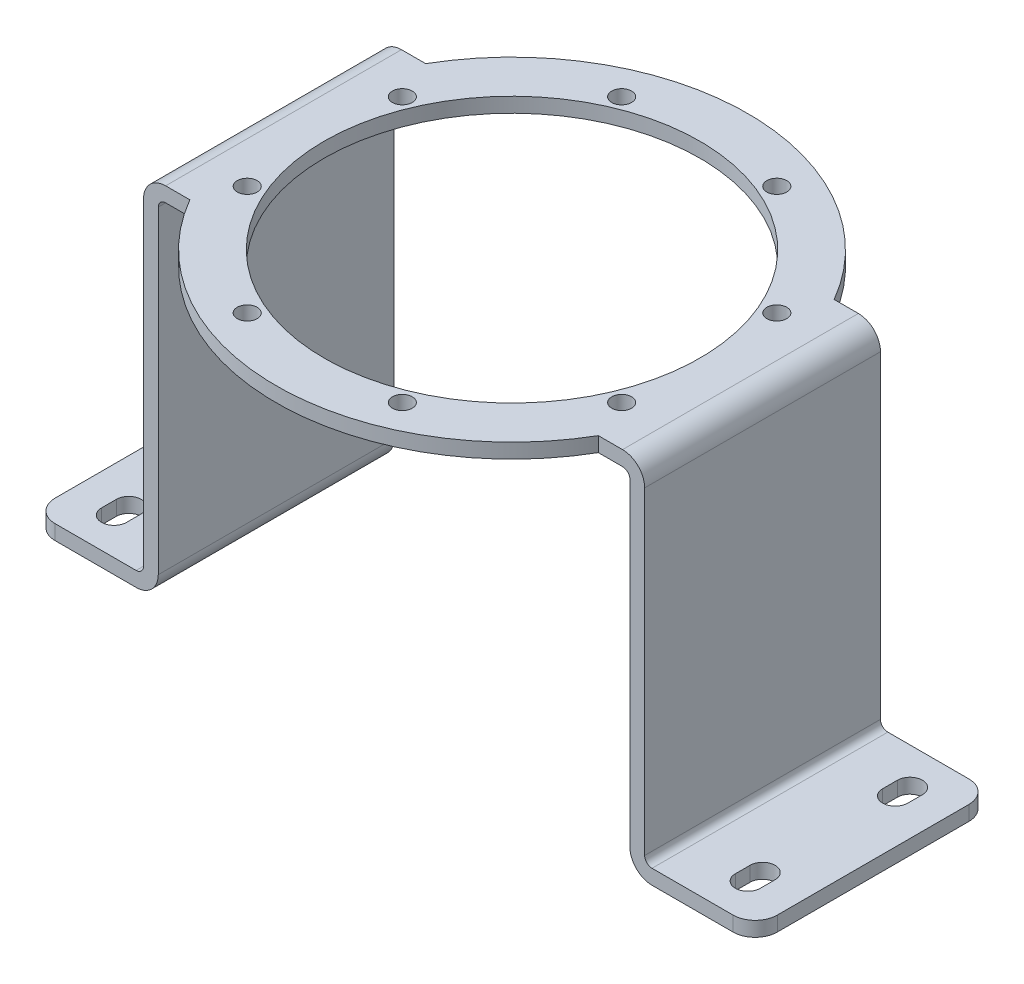
from build123d import *

# Parameters (mm, degrees)
SKETCH_1_R          = 25.5
EXTRUDE_1_DEPTH     = 2
SKETCH_2_W          = 2
SKETCH_2_H          = 32
EXTRUDE_2_DEPTH     = 47.2
SKETCH_3_W          = 32
SKETCH_3_H          = 2
EXTRUDE_3_DEPTH     = 15
FILLET_1_R          = 3
FILLET_2_R          = 1
SKETCH_4_R          = 1.35
CUT_EXTRUDE_1_DEPTH = 10
CUT_EXTRUDE_2_DEPTH = 10
FILLET_3_R          = 3


with BuildPart() as part:
    # 草图1 → 凸台-拉伸1 (new body)
    with BuildSketch(Plane(origin=(0, 53.2, 0), x_dir=(1, 0, 0), z_dir=(0, 1, 0))):
        with BuildLine():
            Line((-34, 16), (-34, -16))
            Line((-34, -16), (-27.712812921, -16))
            ThreePointArc((-27.712812921, -16), (0, -32), (27.712812921, -16))
            Line((27.712812921, -16), (34, -16))
            Line((34, -16), (34, 16))
            Line((34, 16), (27.712812921, 16))
            ThreePointArc((27.712812921, 16), (0, 32), (-27.712812921, 16))
            Line((-27.712812921, 16), (-34, 16))
        make_face()
        with Locations(Location((0, 0, 0), (0, 0, 180))):
            Circle(SKETCH_1_R, mode=Mode.SUBTRACT)
    extrude(amount=EXTRUDE_1_DEPTH)

    # 草图2 → 凸台-拉伸2 (add)
    with BuildSketch(Plane.XZ.offset(-53.2)):
        with Locations((-33, 0)):
            Rectangle(SKETCH_2_W, SKETCH_2_H)
        with Locations((33, 0)):
            Rectangle(SKETCH_2_W, SKETCH_2_H)
    extrude(amount=EXTRUDE_2_DEPTH)

    # 草图3 → 凸台-拉伸3 (add)
    with BuildSketch(Plane.ZY.offset(34)):
        with Locations((0, 7)):
            Rectangle(SKETCH_3_W, SKETCH_3_H)
    extrude_3 = extrude(amount=EXTRUDE_3_DEPTH)

    # 镜向1: 凸台-拉伸3 across plane
    add(extrude_3.mirror(Plane.ZY))

    # 圆角1
    fillet_1_edges = [part.edges().sort_by_distance(p)[0] for p in [
        (34, 55.2, 0),
        (-32, 6, 0),
        (32, 6, 0),
        (-34, 55.2, 0),
    ]]
    fillet(fillet_1_edges, radius=FILLET_1_R)

    # 圆角2
    fillet_2_edges = [part.edges().sort_by_distance(p)[0] for p in [
        (-32, 53.2, 0),
        (32, 53.2, 0),
        (-34, 8, 0),
        (34, 8, 0),
    ]]
    fillet(fillet_2_edges, radius=FILLET_2_R)

    # 草图4 → 切除-拉伸1 (cut)
    with BuildSketch(Plane(origin=(0, 55.2, 0), x_dir=(1, 0, 0), z_dir=(0, 1, 0))):
        with Locations(Location((-10.52379439, 25.406687144, 0), (0, 0, 180))):
            Circle(SKETCH_4_R)
        with Locations(Location((10.52379439, 25.406687144, 0), (0, 0, 180))):
            Circle(SKETCH_4_R)
        with Locations(Location((25.406687144, 10.52379439, 0), (0, 0, 180))):
            Circle(SKETCH_4_R)
        with Locations(Location((25.406687144, -10.52379439, 0), (0, 0, 180))):
            Circle(SKETCH_4_R)
        with Locations(Location((10.52379439, -25.406687144, 0), (0, 0, 180))):
            Circle(SKETCH_4_R)
        with Locations(Location((-10.52379439, -25.406687144, 0), (0, 0, 180))):
            Circle(SKETCH_4_R)
        with Locations(Location((-25.406687144, -10.52379439, 0), (0, 0, 180))):
            Circle(SKETCH_4_R)
        with Locations(Location((-25.406687144, 10.52379439, 0), (0, 0, 180))):
            Circle(SKETCH_4_R)
    extrude(amount=-CUT_EXTRUDE_1_DEPTH, mode=Mode.SUBTRACT)

    # 草图6 → 切除-拉伸2 (cut)
    with BuildSketch(Plane(origin=(0, 8, 0), x_dir=(1, 0, 0), z_dir=(0, 1, 0))):
        with BuildLine():
            Line((-41.3, 11), (-41.3, 9))
            ThreePointArc((-41.3, 9), (-43, 7.3), (-44.7, 9))
            Line((-44.7, 9), (-44.7, 11))
            ThreePointArc((-44.7, 11), (-43, 12.7), (-41.3, 11))
        make_face()
        with BuildLine():
            Line((-41.3, -11), (-41.3, -9))
            ThreePointArc((-41.3, -9), (-43, -7.3), (-44.7, -9))
            Line((-44.7, -9), (-44.7, -11))
            ThreePointArc((-44.7, -11), (-43, -12.7), (-41.3, -11))
        make_face()
    cut_extrude_2 = extrude(amount=-CUT_EXTRUDE_2_DEPTH, mode=Mode.SUBTRACT)

    # 镜向2: 切除-拉伸2 across plane
    add(cut_extrude_2.mirror(Plane.ZY), mode=Mode.SUBTRACT)

    # 圆角3
    fillet_3_edges = [part.edges().sort_by_distance(p)[0] for p in [
        (-49, 7, 16),
        (-49, 7, -16),
        (49, 7, 16),
        (49, 7, -16),
    ]]
    fillet(fillet_3_edges, radius=FILLET_3_R)


solid = part.part
